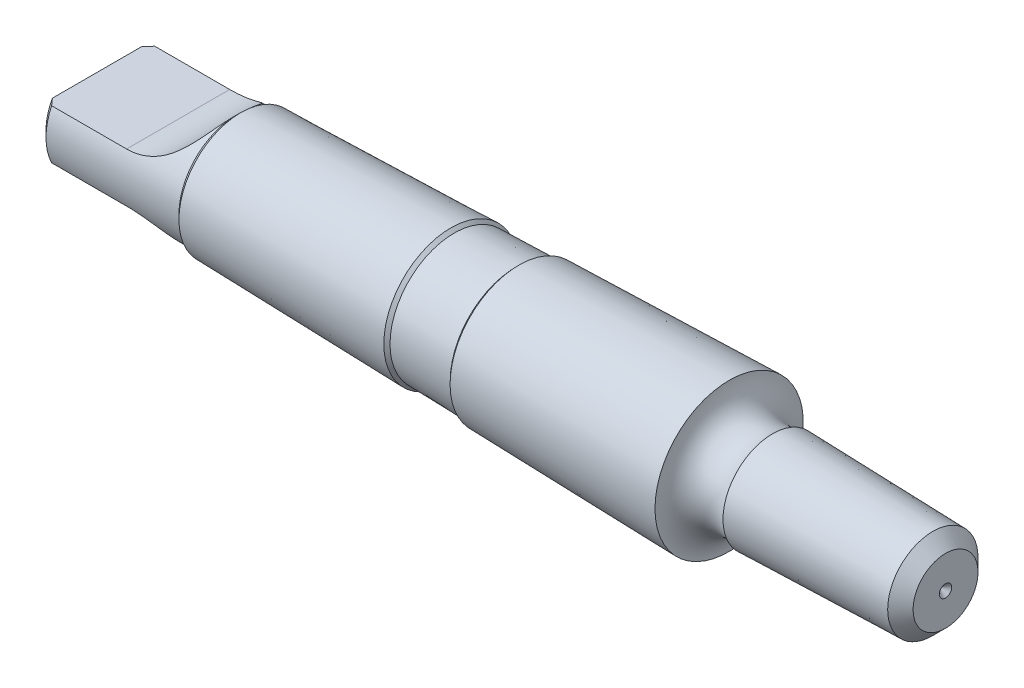
from build123d import *

# Parameters (mm, degrees)
CHANFREIN1_SIZE         = 1
CHANFREIN2_SIZE         = 2
CHANFREIN2_SIZE2        = 2.055782961
ENL_V_MAT_EXTRU_1_DEPTH = 15


with BuildPart() as part:
    # Esquisse1 → Révolution1 (revolve)
    with BuildSketch(Plane.XY, mode=Mode.PRIVATE) as r_volution1_sk:
        with BuildLine():
            Line((-102.251641217, 9.25), (-79.75, 9.25))
            Line((-79.75, 9.25), (-79, 10))
            Line((-79, 10), (-44.998238309, 10.860804093))
            Line((-44.998238309, 10.860804093), (-44.485744289, 10.373618421))
            Line((-44.485744289, 10.373618421), (-34.488947364, 10.626701887))
            Line((-34.488947364, 10.626701887), (-34.001761691, 11.139195907))
            Line((-34.001761691, 11.139195907), (0, 12))
            ThreePointArc((0, 12), (2.339354929, 7.968871126), (7, 8))
            Line((7, 8), (35, 7.25))
            Line((35, 7.25), (35, 1))
            Line((35, 1), (34, 0))
            Line((34, 0), (-101.251641217, 0))
            Line((-101.251641217, 0), (-102.251641217, 1))
            Line((-102.251641217, 1), (-102.251641217, 9.25))
        make_face()
    revolve(r_volution1_sk.sketch.rotate(Axis((0, 0, 0), (1, 0, 0)), 90), axis=Axis((0, 0, 0), (1, 0, 0)))

    # Chanfrein1
    chanfrein1_edges = [part.edges().sort_by_distance(p)[0] for p in [
        (-102.251641217, 0, -9.25),
    ]]
    chamfer(chanfrein1_edges, length=CHANFREIN1_SIZE)

    # Chanfrein2
    chanfrein2_edges = [part.edges().sort_by_distance(p)[0] for p in [
        (35, 0, -7.25),
    ]]
    chanfrein2_side = [part.faces().sort_by_distance(p)[0] for p in [
        (35, 0, -7.044939033),
    ]]
    chamfer(chanfrein2_edges, length=CHANFREIN2_SIZE, length2=CHANFREIN2_SIZE2, reference=chanfrein2_side[0])

    # Esquisse2 → Enlèv. mat.-Extru.1 (cut, symmetric)
    with BuildSketch(Plane.XY):
        with BuildLine():
            Line((-89.127499667, 4), (-102.251641217, 4))
            Line((-102.251641217, 4), (-102.251641217, 16))
            Line((-102.251641217, 16), (-78.127499667, 16))
            Line((-78.127499667, 16), (-78.127499667, 15))
            ThreePointArc((-78.127499667, 15), (-81.349325074, 7.221825407), (-89.127499667, 4))
        make_face()
    enl_v_mat_extru_1 = extrude(amount=ENL_V_MAT_EXTRU_1_DEPTH, both=True, mode=Mode.SUBTRACT)

    # Symétrie1: Enlèv. mat.-Extru.1 across plane
    add(enl_v_mat_extru_1.mirror(Plane.ZX), mode=Mode.SUBTRACT)


solid = part.part
